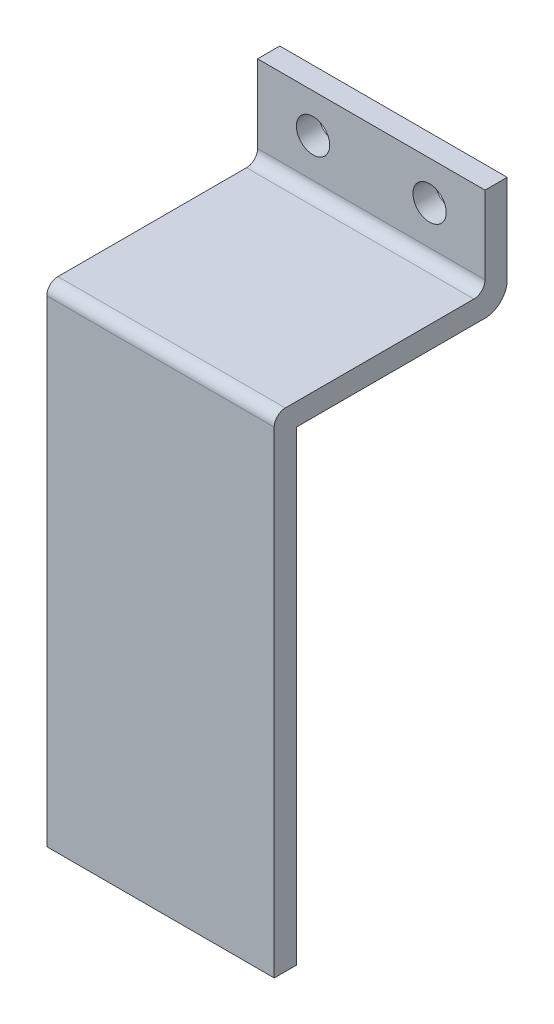
from build123d import *

# Parameters (mm, degrees)
BOSS_EXTRUDE1_DEPTH = 20.5
SKETCH2_R           = 1.5
CUT_EXTRUDE1_DEPTH  = 60.036005962


with BuildPart() as part:
    # Sketch1 → Boss-Extrude1 (new body)
    with BuildSketch(Plane(origin=(0, 0, 0), x_dir=(0, 0, -1), z_dir=(1, 0, 0))):
        with BuildLine():
            Line((0, 0), (0, 43))
            ThreePointArc((0, 43), (0.292893219, 43.707106781), (1, 44))
            Line((1, 44), (18, 44))
            ThreePointArc((18, 44), (18.707106781, 44.292893219), (19, 45))
            Line((19, 45), (19, 52))
            Line((19, 52), (21, 52))
            Line((21, 52), (21, 44))
            ThreePointArc((21, 44), (20.414213562, 42.585786438), (19, 42))
            Line((19, 42), (2, 42))
            Line((2, 42), (2, 0))
            Line((2, 0), (0, 0))
        make_face()
    extrude(amount=BOSS_EXTRUDE1_DEPTH)

    # Sketch2 → Cut-Extrude1 (cut, through all)
    with BuildSketch(Plane.XY.offset(-19)):
        with Locations((5, 48.5)):
            Circle(SKETCH2_R)
        with Locations(Location((15.5, 48.5, 0), (0, 0, 180))):
            Circle(SKETCH2_R)
    extrude(amount=-CUT_EXTRUDE1_DEPTH, mode=Mode.SUBTRACT)


solid = part.part
